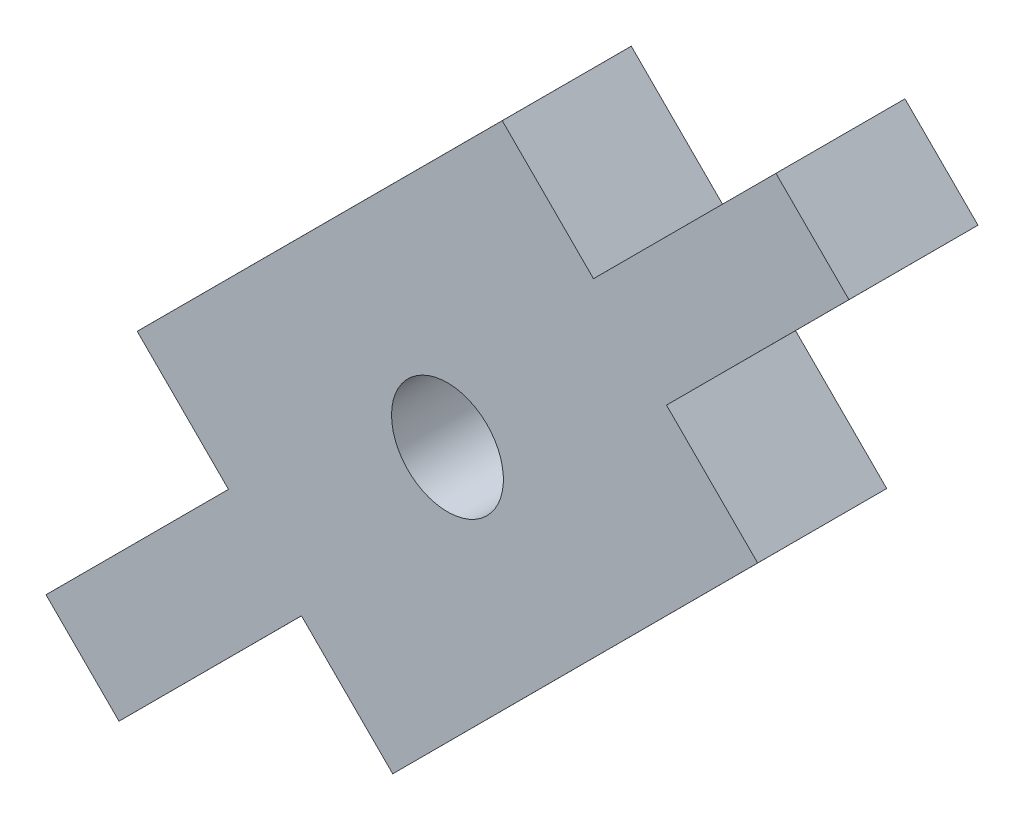
from build123d import *

# Parameters (mm, degrees)
SKETCH_1_R      = 1.3
EXTRUDE_1_DEPTH = 3


with BuildPart() as part:
    # 草图1 → 凸台-拉伸1 (new body)
    with BuildSketch(Plane.XY.offset(-0.362857667)):
        Polygon((-3.676296375, 21.322205006), (-1.554532399, 19.201048196), (-5.796882426, 14.957483824), (-4.099819599, 13.25965297), (0.142530428, 17.503217343), (2.264294404, 15.382060533), (10.749072595, 23.869267436), (8.629080401, 25.98865297), (12.871430428, 30.232217343), (11.173246227, 31.927912314), (6.931968366, 27.685420414), (4.810204389, 29.806577223), align=None)
        with Locations(Location((3.536567574, 22.593983824, 0), (0, 0, 180))):
            Circle(SKETCH_1_R, mode=Mode.SUBTRACT)
    extrude(amount=-EXTRUDE_1_DEPTH)


solid = part.part
